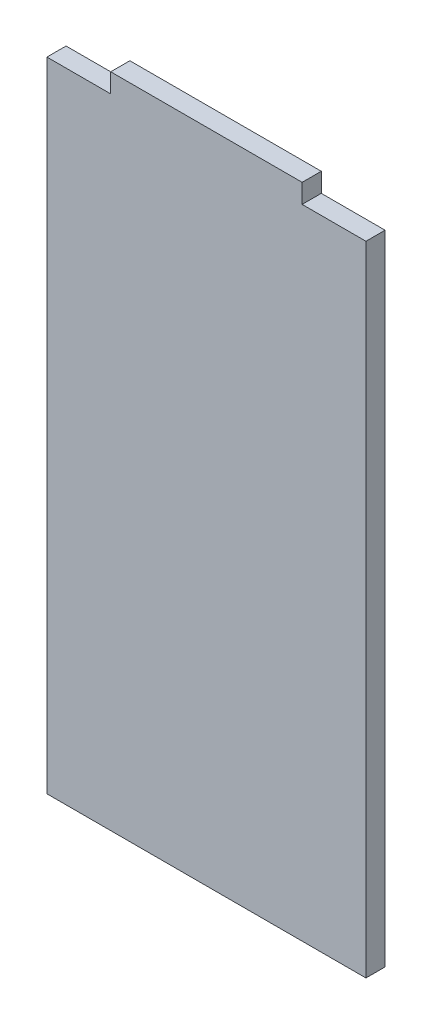
from build123d import *

# Parameters (mm, degrees)
SKETCH_1_W      = 30
SKETCH_1_H      = 3
EXTRUDE_1_DEPTH = 3


with BuildPart() as part:
    # Эскиз1 → Бобышка-Вытянуть1 (new body)
    with BuildSketch(Plane.XY):
        Polygon((-25, 50), (-25, -50), (25, -50), (25, 50), (15, 50), (15, 47), (-15, 47), (-15, 50), align=None)
        with Locations((0, 48.5)):
            Rectangle(SKETCH_1_W, SKETCH_1_H)
        with Locations((0, 51.5)):
            Rectangle(SKETCH_1_W, SKETCH_1_H)
    extrude(amount=EXTRUDE_1_DEPTH)


solid = part.part
